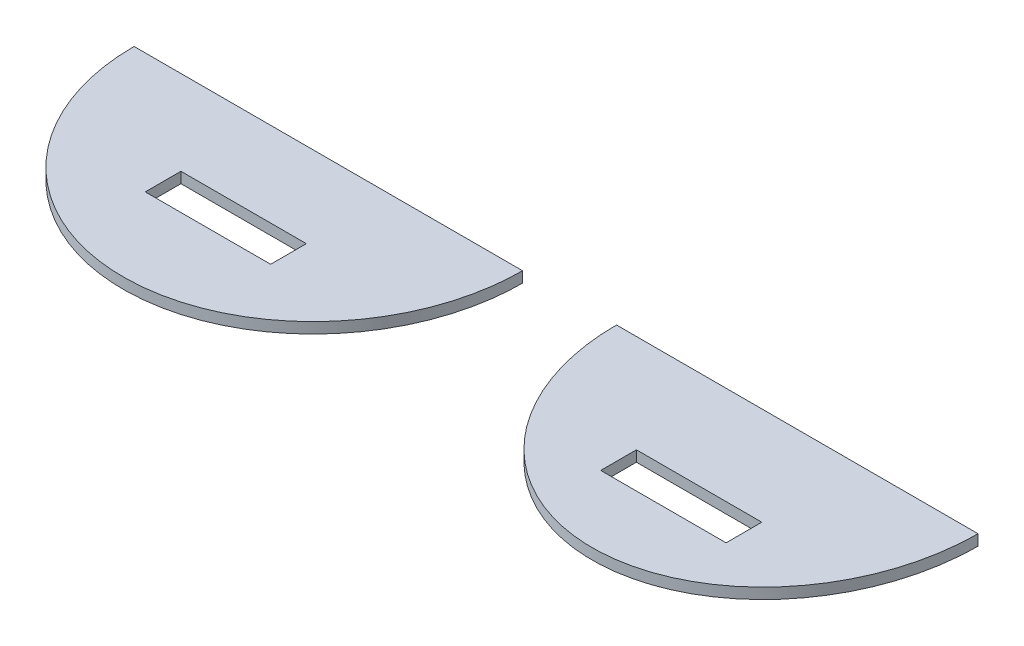
from build123d import *

# Parameters (mm, degrees)
SKETCH2_W             = 29.5148
SKETCH2_H             = 8.4074
BOSS_EXTRUDE2_DEPTH   = 2.54
BOSS_EXTRUDE2_2_DEPTH = 2.54


with BuildPart() as part:
    # Sketch2 → Boss-Extrude2 (new body)
    with BuildSketch(Plane(origin=(0, 0, 0), x_dir=(1, 0, 0), z_dir=(0, 1, 0))):
        with BuildLine():
            Line((-149.141343613, 135.015597238), (-57.701343613, 135.015597238))
            add(Edge.make_bspline(
                [(-149.141343613, 135.015597238), (-149.141343613, 86.755597238), (-103.421343613, 86.755597238), (-57.701343613, 86.755597238), (-57.701343613, 135.015597238)],
                knots=[1.570796327, 1.570796327, 1.570796327, 3.141592654, 3.141592654, 4.71238898, 4.71238898, 4.71238898], degree=2, weights=[1, 0.707106781, 1, 0.707106781, 1]))
        make_face()
        with Locations((-103.421343613, 110.885597238)):
            Rectangle(SKETCH2_W, SKETCH2_H, mode=Mode.SUBTRACT)
    extrude(amount=BOSS_EXTRUDE2_DEPTH)


with BuildPart() as body_2:
    # Sketch2 → Boss-Extrude2 2 (new body)
    with BuildSketch(Plane(origin=(0, 0, 0), x_dir=(1, 0, 0), z_dir=(0, 1, 0))):
        with BuildLine():
            Line((49.508796617, 135.015597238), (-35.581203383, 135.015597238))
            add(Edge.make_bspline(
                [(-35.581203383, 135.015597238), (-35.581203383, 86.755597238), (6.963796617, 86.755597238), (49.508796617, 86.755597238), (49.508796617, 135.015597238)],
                knots=[4.71238898, 4.71238898, 4.71238898, 6.283185307, 6.283185307, 7.853981634, 7.853981634, 7.853981634], degree=2, weights=[1, 0.707106781, 1, 0.707106781, 1]))
        make_face()
        with Locations((6.963796617, 107.710597238)):
            Rectangle(SKETCH2_W, SKETCH2_H, mode=Mode.SUBTRACT)
    extrude(amount=BOSS_EXTRUDE2_2_DEPTH)


solid = Compound([part.part, body_2.part])
